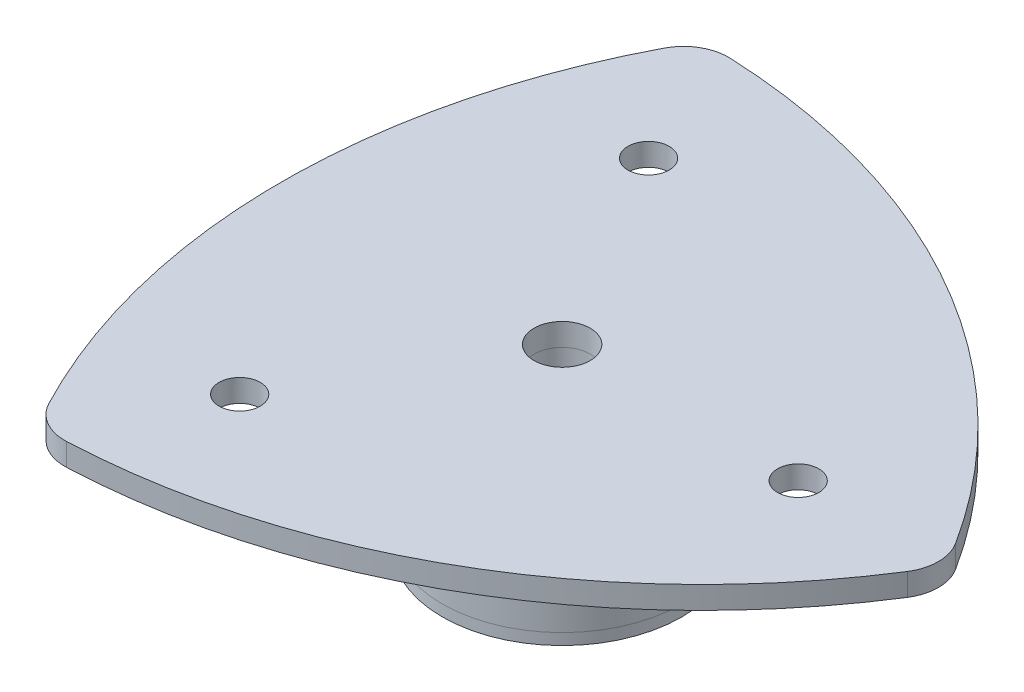
from build123d import *

# Parameters (mm, degrees)
SKETCH_3_W          = 22.5
SKETCH_3_H          = 38
EXTRUDE_1_DEPTH     = 6
SKETCH_6_R          = 5.5
CUT_EXTRUDE_1_DEPTH = 6
FILLET_1_R          = 12


with BuildPart() as part:
    # 草图2 → 旋转1 (revolve)
    with BuildSketch(Plane.XY, mode=Mode.PRIVATE) as revolve_1_sk:
        Polygon((30, 0), (32, 0), (32, 3), (9.5, 3), (9.5, 41), (7.5, 41), (7.5, 1), (30, 1), align=None)
    revolve(revolve_1_sk.sketch.rotate(Axis((0, 0, 0), (0, 1, 0)), 90), axis=Axis((0, 0, 0), (0, 1, 0)))


with BuildPart() as body_2:
    # 草图3 → 旋转2 (revolve)
    with BuildSketch(Plane.XY, mode=Mode.PRIVATE) as revolve_2_sk:
        with Locations((20.75, 22)):
            Rectangle(SKETCH_3_W, SKETCH_3_H)
    revolve(revolve_2_sk.sketch.rotate(Axis((0, 0, 0), (0, 1, 0)), 90), axis=Axis((0, 0, 0), (0, 1, 0)))


with BuildPart() as body_3:
    # 草图4 → 旋转3 (revolve)
    with BuildSketch(Plane.XY, mode=Mode.PRIVATE) as revolve_3_sk:
        Polygon((32, 41), (32, 27), (38, 27), (38, 41), (75, 41), (75, 47), (32, 47), (7.5, 47), (7.5, 41), align=None)
    revolve(revolve_3_sk.sketch.rotate(Axis((0, 0, 0), (0, 1, 0)), 90), axis=Axis((0, 0, 0), (0, 1, 0)))

    # 草图5 → 凸台-拉伸1 (add)
    with BuildSketch(Plane(origin=(0, 47, 0), x_dir=(1, 0, 0), z_dir=(0, 1, 0))):
        with BuildLine():
            ThreePointArc((37.499997067, 64.951906977), (75, 4.86e-07), (37.499997908, -64.951906491))
            ThreePointArc((37.499997908, -64.951906491), (74.251492065, -36.751493773), (102.451905284, 0))
            ThreePointArc((102.451905284, 0), (74.251491722, 36.751494116), (37.499997067, 64.951906977))
        make_face()
        with BuildLine():
            ThreePointArc((-75, 0), (-37.500001466, 64.951904437), (37.499997067, 64.951906977))
            ThreePointArc((37.499997067, 64.951906977), (-5.2980216, 82.679426034), (-51.225952642, 88.725952642))
            ThreePointArc((-51.225952642, 88.725952642), (-68.953472954, 45.927932677), (-75, 0))
        make_face()
        with BuildLine():
            ThreePointArc((-51.225952642, -88.725952642), (-5.298021131, -82.679425908), (37.499997908, -64.951906491))
            ThreePointArc((37.499997908, -64.951906491), (-37.500001046, -64.95190468), (-75, 0))
            ThreePointArc((-75, 0), (-68.953472954, -45.927932677), (-51.225952642, -88.725952642))
        make_face()
    extrude(amount=-EXTRUDE_1_DEPTH)

    # 草图6 → 切除-拉伸1 (cut)
    with BuildSketch(Plane(origin=(0, 47, 0), x_dir=(1, 0, 0), z_dir=(0, 1, 0))):
        with Locations(Location((-31.5, 54.559600438, 0), (0, 0, 270))):
            Circle(SKETCH_6_R)
        with Locations(Location((-31.5, -54.559600438, 0), (0, 0, 270))):
            Circle(SKETCH_6_R)
        with Locations(Location((63, 0, 0), (0, 0, 270))):
            Circle(SKETCH_6_R)
    extrude(amount=-CUT_EXTRUDE_1_DEPTH, mode=Mode.SUBTRACT)

    # 圆角1
    fillet_1_edges = [body_3.edges().sort_by_distance(p)[0] for p in [
        (-51.225952642, 44, -88.725952642),
        (-51.225952642, 44, 88.725952642),
        (102.451905284, 44, 0),
    ]]
    fillet(fillet_1_edges, radius=FILLET_1_R)


solid = Compound([part.part, body_2.part, body_3.part])
